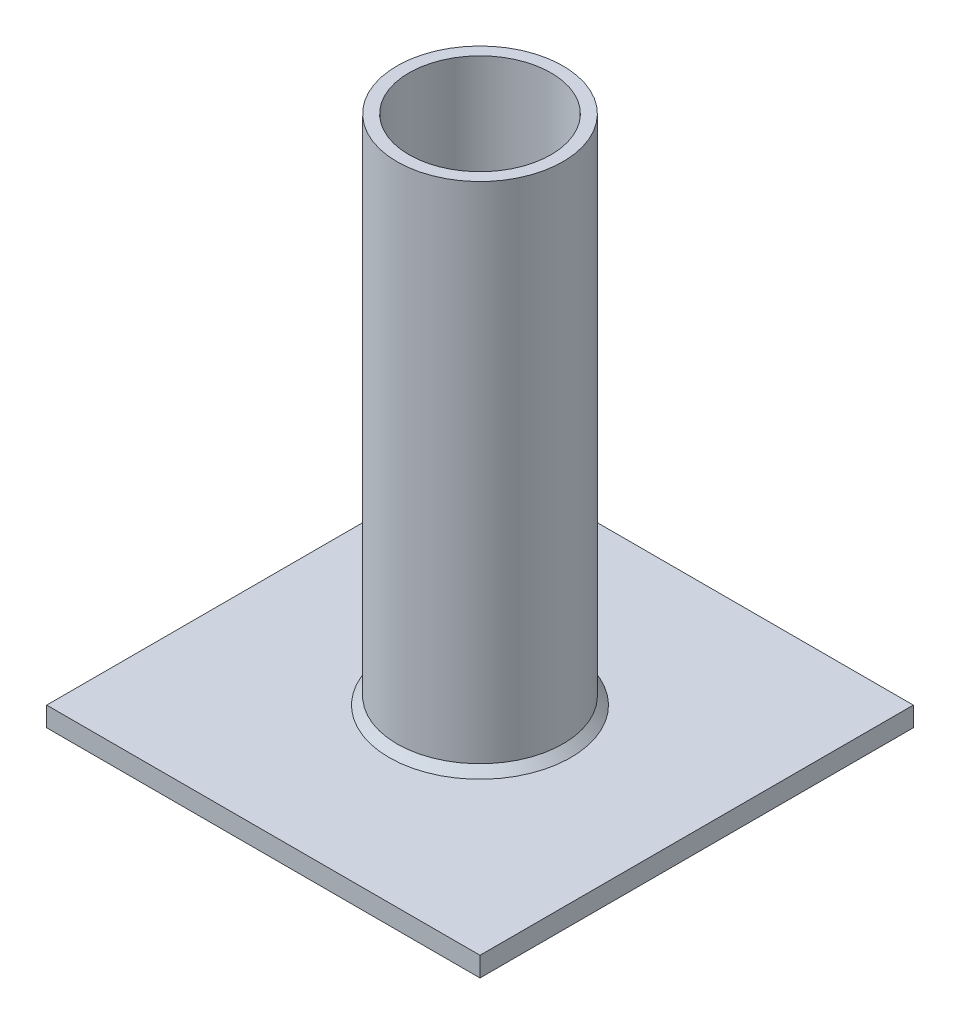
from build123d import *

# Parameters (mm, degrees)
SKETCH1_W           = 110
SKETCH1_H           = 110
BOSS_EXTRUDE1_DEPTH = 5
SKETCH2_R           = 21.075
SKETCH2_R_2         = 18.025
BOSS_EXTRUDE2_DEPTH = 130
CHAMFER1_SIZE       = 2


with BuildPart() as part:
    # Sketch1 → Boss-Extrude1 (new body)
    with BuildSketch(Plane(origin=(0, 0, 0), x_dir=(1, 0, 0), z_dir=(0, 1, 0))):
        Rectangle(SKETCH1_W, SKETCH1_H)
    extrude(amount=BOSS_EXTRUDE1_DEPTH)

    # Sketch2 → Boss-Extrude2 (add)
    with BuildSketch(Plane(origin=(0, 5, 0), x_dir=(1, 0, 0), z_dir=(0, 1, 0))):
        with Locations(Location((0, 0, 0), (0, 0, 270))):
            Circle(SKETCH2_R)
        with Locations(Location((0, 0, 0), (0, 0, 270))):
            Circle(SKETCH2_R_2, mode=Mode.SUBTRACT)
    extrude(amount=BOSS_EXTRUDE2_DEPTH)

    # Chamfer1
    chamfer1_edges = [part.edges().sort_by_distance(p)[0] for p in [
        (0, 5, -21.075),
    ]]
    chamfer(chamfer1_edges, length=CHAMFER1_SIZE)


solid = part.part
